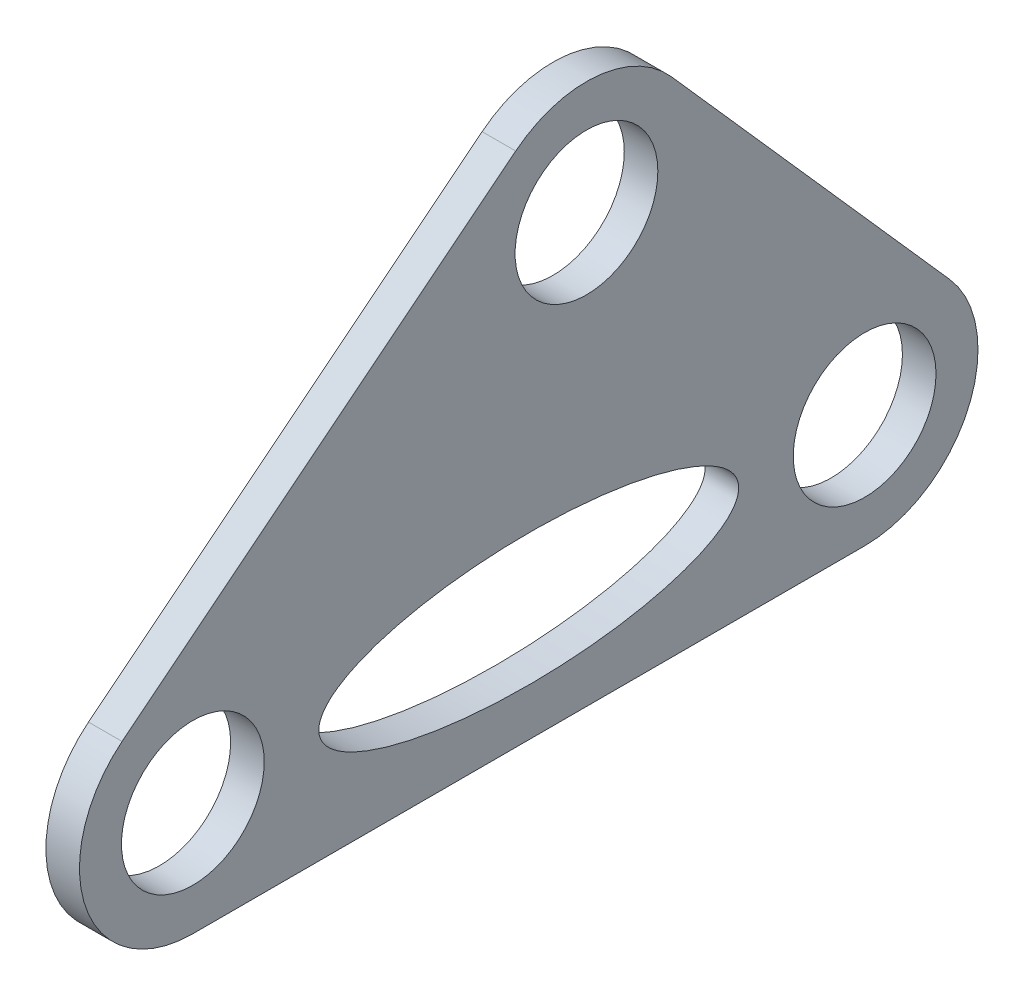
from build123d import *

# Parameters (mm, degrees)
SKETCH_2_R          = 8.5
EXTRUDE_1_DEPTH     = 4
SKETCH_3_RX         = 25
SKETCH_3_RY         = 7.848678542
CUT_EXTRUDE_1_DEPTH = 10


with BuildPart() as part:
    # 草图2 → 凸台-拉伸1 (new body)
    with BuildSketch(Plane(origin=(0, 0, 0), x_dir=(0, 0, -1), z_dir=(1, 0, 0))):
        with BuildLine():
            ThreePointArc((38.448053475, 47.999970666), (48.038029113, 50.902904709), (56.98733583, 46.396845666))
            Line((56.98733583, 46.396845666), (90.11233583, 8.94375))
            ThreePointArc((90.11233583, 8.94375), (92.308343207, -5.545690895), (80, -13.5))
            Line((80, -13.5), (0, -13.5))
            ThreePointArc((0, -13.5), (-12.74034561, -4.464705337), (-8.426946525, 10.546875))
            Line((-8.426946525, 10.546875), (38.448053475, 47.999970666))
        make_face()
        with Locations((80, 0)):
            Circle(SKETCH_2_R, mode=Mode.SUBTRACT)
        with Locations((46.875, 37.453095666)):
            Circle(SKETCH_2_R, mode=Mode.SUBTRACT)
        Circle(SKETCH_2_R, mode=Mode.SUBTRACT)
    extrude(amount=EXTRUDE_1_DEPTH)

    # 草图3 → 切除-拉伸1 (cut)
    with BuildSketch(Plane(origin=(4, 0, 0), x_dir=(0, 0, -1), z_dir=(1, 0, 0))):
        with Locations((40, 0)):
            Ellipse(SKETCH_3_RX, SKETCH_3_RY)
    extrude(amount=-CUT_EXTRUDE_1_DEPTH, mode=Mode.SUBTRACT)


solid = part.part
